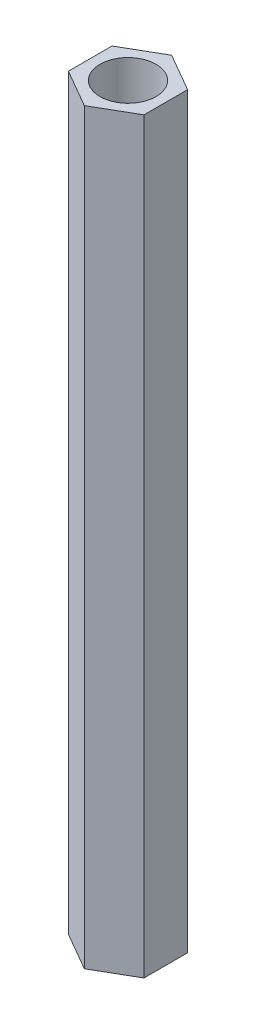
from build123d import *

# Parameters (mm, degrees)
SKETCH_1_R      = 1.5
EXTRUDE_1_DEPTH = 40


with BuildPart() as part:
    # 草图1 → 凸台-拉伸1 (new body)
    with BuildSketch(Plane(origin=(0, 0, 0), x_dir=(1, 0, 0), z_dir=(0, 1, 0))):
        Polygon((2.022169318, 1.1675), (0, 2.335), (-2.022169318, 1.1675), (-2.022169318, -1.1675), (0, -2.335), (2.022169318, -1.1675), align=None)
        with Locations(Location((0, 0, 0), (0, 0, 270))):
            Circle(SKETCH_1_R, mode=Mode.SUBTRACT)
    extrude(amount=EXTRUDE_1_DEPTH)


solid = part.part
